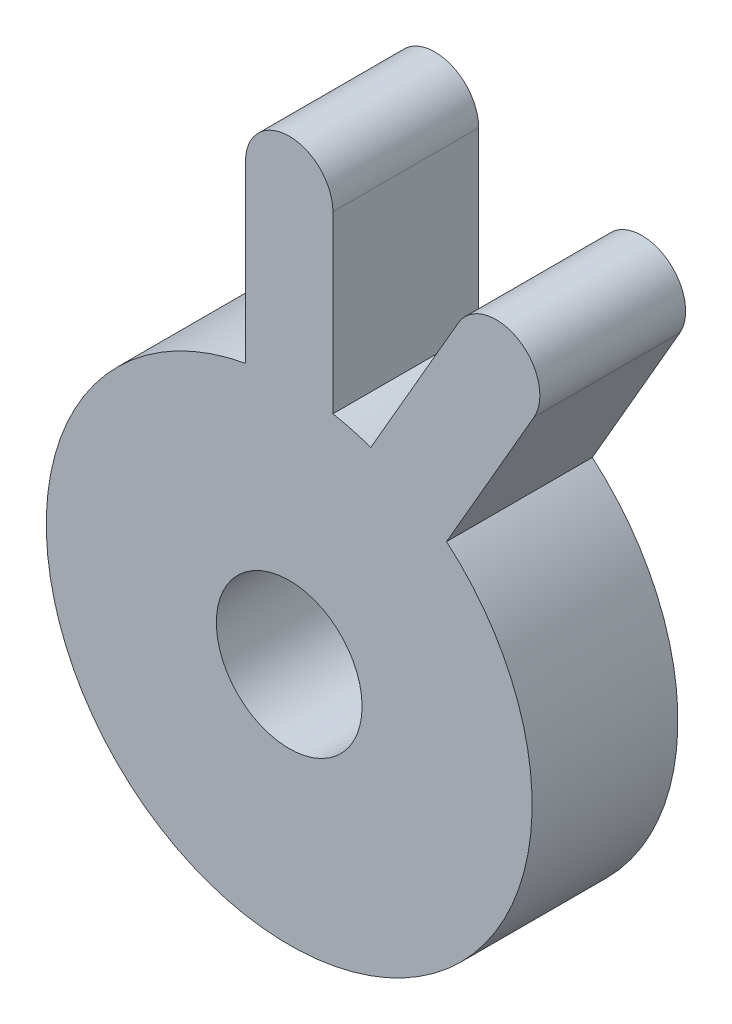
from build123d import *

# Parameters (mm, degrees)
SKETCH1_R           = 25
SKETCH1_R_2         = 7.5
BOSS_EXTRUDE1_DEPTH = 15


with BuildPart() as part:
    # Sketch1 → Boss-Extrude1 (new body)
    # profile 1 of 3: a face of its own
    with BuildSketch(Plane.XY):
        Circle(SKETCH1_R)
        Circle(SKETCH1_R_2, mode=Mode.SUBTRACT)
    # profile 2 of 3: a face of its own
    with BuildSketch(Plane.XY):
        with BuildLine():
            Line((-4.5, 42.591665255), (-4.5, 24.591665255))
            ThreePointArc((-4.5, 24.591665255), (0, 25), (4.5, 24.591665255))
            Line((4.5, 24.591665255), (4.5, 42.591665255))
            ThreePointArc((4.5, 42.591665255), (0, 47.091665255), (-4.5, 42.591665255))
        make_face()
    # profile 3 of 3: a face of its own
    with BuildSketch(Plane.XY):
        with BuildLine():
            Line((17.39871831, 39.1354641), (8.39871831, 23.547006832))
            ThreePointArc((8.39871831, 23.547006832), (12.5, 21.650635095), (16.192946944, 19.047006832))
            Line((16.192946944, 19.047006832), (25.192946944, 34.6354641))
            ThreePointArc((25.192946944, 34.6354641), (23.545832627, 40.782578417), (17.39871831, 39.1354641))
        make_face()
    extrude(amount=BOSS_EXTRUDE1_DEPTH)


solid = part.part
